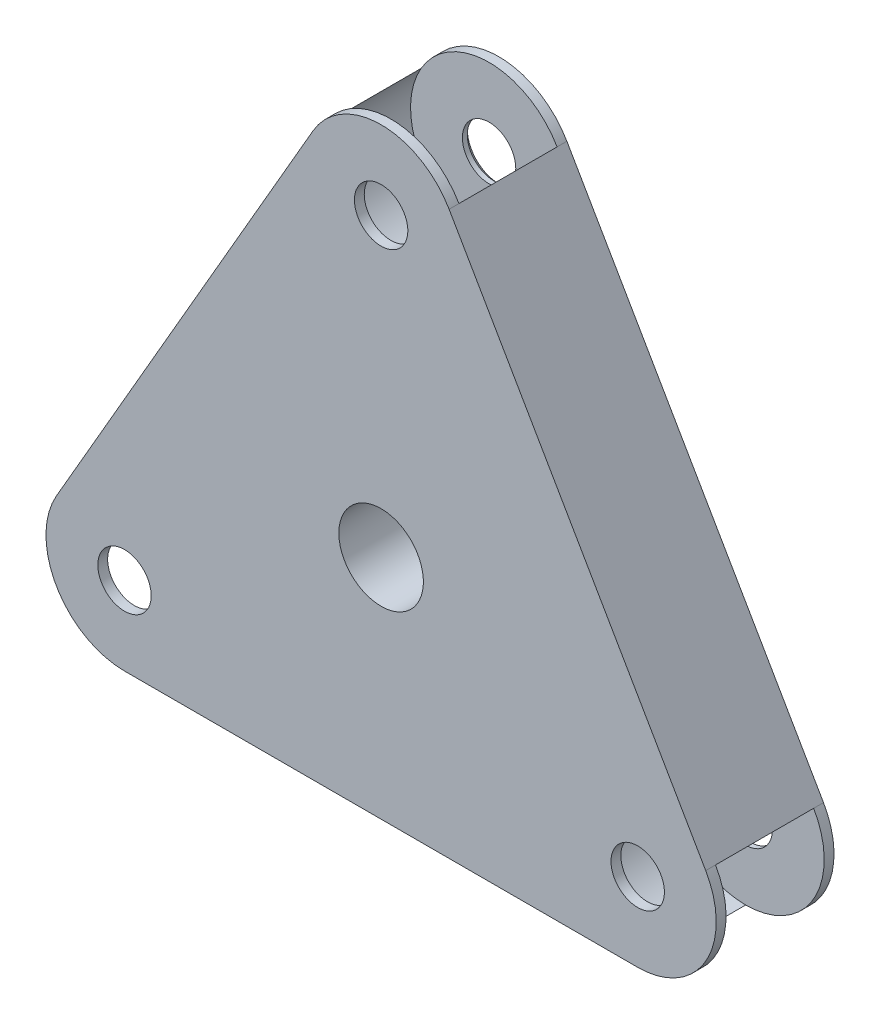
from build123d import *

# Parameters (mm, degrees)
BOSS_EXTRU_1_DEPTH           = 15
ENL_V_START                  = 7.5
ESQUISSE2_R                  = 10
ENL_V_MAT_EXTRU_1_DEPTH      = 6.25
R_P_TITION_CIRCULAIRE1_COUNT = 3
TROU_TARAUD_M81_D            = 6.8
TROU_TARAUD_M81_CSINK_D      = 8.05
TROU_TARAUD_M81_CSINK_ANGLE  = 90
ESQUISSE7_R                  = 7.460158596
ESQUISSE7_R_2                = 5.383247208
BOSS_EXTRU_2_DEPTH           = 12.5
ESQUISSE7_3_R                = 5.383247208
ENL_V_MAT_EXTRU_2_DEPTH      = 66.766038545


with BuildPart() as part:
    # Esquisse1 → Boss.-Extru.1 (new body)
    with BuildSketch(Plane.XY):
        with BuildLine():
            Line((-8.660254038, 42.735026919), (-41.339745962, -13.867513459))
            ThreePointArc((-41.339745962, -13.867513459), (-41.339745962, -23.867513459), (-32.679491924, -28.867513459))
            Line((-32.679491924, -28.867513459), (32.679491924, -28.867513459))
            ThreePointArc((32.679491924, -28.867513459), (41.339745962, -23.867513459), (41.339745962, -13.867513459))
            Line((41.339745962, -13.867513459), (8.660254038, 42.735026919))
            ThreePointArc((8.660254038, 42.735026919), (0, 47.735026919), (-8.660254038, 42.735026919))
        make_face()
    extrude(amount=BOSS_EXTRU_1_DEPTH)

    # Esquisse2 → Enlèv. mat.-Extru.1 (cut, symmetric)
    with BuildSketch(Plane.XY.offset(ENL_V_START)):
        with Locations((0, 37.735026919)):
            Circle(ESQUISSE2_R)
    enl_v_mat_extru_1 = extrude(amount=ENL_V_MAT_EXTRU_1_DEPTH, both=True, mode=Mode.SUBTRACT)

    # Répétition circulaire1: Enlèv. mat.-Extru.1 ×3 about axis
    r_p_tition_circulaire1_axis = Axis((0, 0, -0.550606868), (0, 0, -1))
    for i in range(1, R_P_TITION_CIRCULAIRE1_COUNT):
        add(enl_v_mat_extru_1.rotate(r_p_tition_circulaire1_axis, i * 360 / R_P_TITION_CIRCULAIRE1_COUNT), mode=Mode.SUBTRACT)

    # Trou taraudé M81 (through all)
    with Locations(Plane(origin=(0, 0, 0), x_dir=(-1, 0, 0), z_dir=(0, 0, -1))):
        with Locations((0, 37.735026919), (32.679491924, -18.867513459), (-32.679491924, -18.867513459)):
            CounterSinkHole(TROU_TARAUD_M81_D / 2, TROU_TARAUD_M81_CSINK_D / 2, counter_sink_angle=TROU_TARAUD_M81_CSINK_ANGLE)

    # Esquisse7 → Boss.-Extru.2 (add)
    with BuildSketch(Plane(origin=(0, 0, 0), x_dir=(-1, 0, 0), z_dir=(0, 0, -1))):
        Circle(ESQUISSE7_R)
        Circle(ESQUISSE7_R_2, mode=Mode.SUBTRACT)
    extrude(amount=BOSS_EXTRU_2_DEPTH)

    # Esquisse7<3> → Enlèv. mat.-Extru.2 (cut, through all)
    with BuildSketch(Plane(origin=(0, 0, 0), x_dir=(-1, 0, 0), z_dir=(0, 0, -1))):
        Circle(ESQUISSE7_3_R)
    extrude(amount=-ENL_V_MAT_EXTRU_2_DEPTH, mode=Mode.SUBTRACT)


solid = part.part
